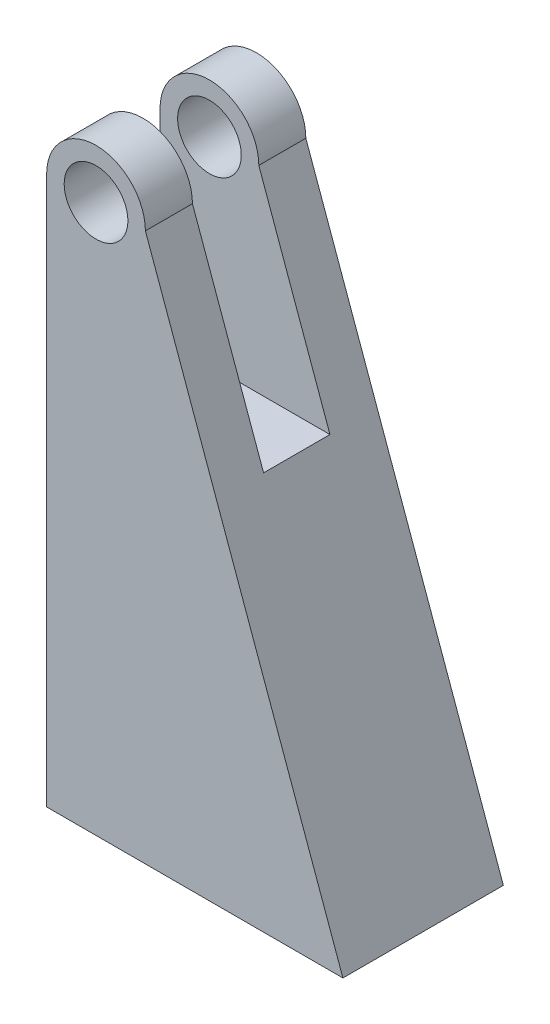
from build123d import *

# Parameters (mm, degrees)
RESSALTO_EXTRUS_O1_DEPTH      = 16.0875
RESSALTO_EXTRUS_O1_DEPTH_BACK = 0.158383869
ESBO_O2_W                     = 6.720883869
ESBO_O2_H                     = 25
CORTE_EXTRUS_O1_DEPTH         = 55.655025447
ESBO_O3_R                     = 3.225
CORTE_EXTRUS_O2_DEPTH         = 53.127659578


with BuildPart() as part:
    # Esboço1 → Ressalto-extrusão1 (new, two sides: drawn at the far end of the back side and taken through both)
    with BuildSketch(Plane.XY.offset(-RESSALTO_EXTRUS_O1_DEPTH_BACK)):
        with BuildLine():
            ThreePointArc((-5, 12.759375), (0, 17.759375), (5, 12.759375))
            Line((5, 12.759375), (5, -12.759375))
            Line((5, -12.759375), (-5, -12.759375))
            Line((-5, -12.759375), (-5, 12.759375))
        make_face()
        Polygon((-5, -42.759375), (-5, -12.759375), (5, -12.759375), (5, 12.759375), (25, -42.759375), align=None)
    extrude(amount=RESSALTO_EXTRUS_O1_DEPTH + RESSALTO_EXTRUS_O1_DEPTH_BACK)

    # Esboço2 → Corte-extrusão1 (cut, through all)
    with BuildSketch(Plane.ZY.offset(5)):
        with Locations((7.964558066, 5.259375)):
            Rectangle(ESBO_O2_W, ESBO_O2_H)
    extrude(amount=-CORTE_EXTRUS_O1_DEPTH, mode=Mode.SUBTRACT)

    # Esboço3 → Corte-extrusão2 (cut, through all)
    with BuildSketch(Plane(origin=(0, 0, -0.158383869), x_dir=(-1, 0, 0), z_dir=(0, 0, -1))):
        with Locations((0, 12.759375)):
            Circle(ESBO_O3_R)
    extrude(amount=-CORTE_EXTRUS_O2_DEPTH, mode=Mode.SUBTRACT)


solid = part.part
